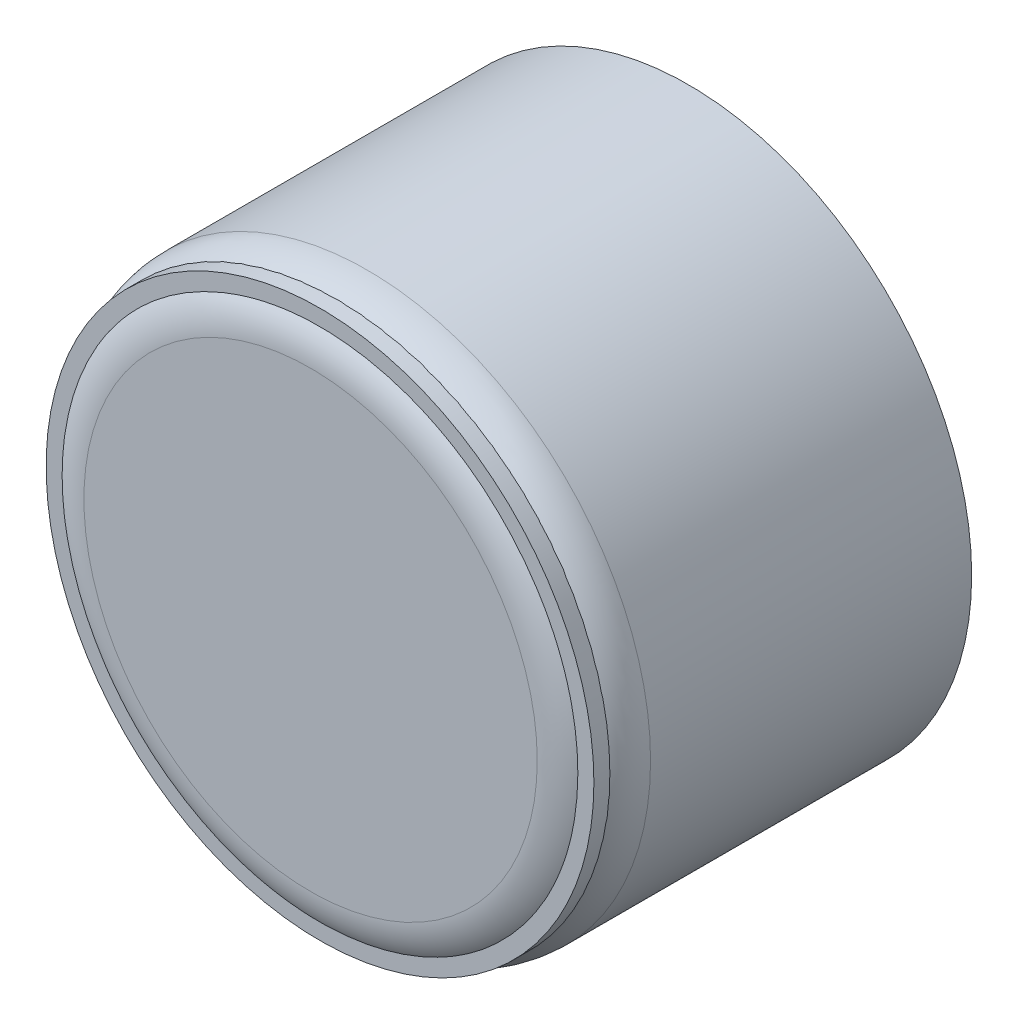
from build123d import *

# Parameters (mm, degrees)
SKETCH_1_R      = 15
EXTRUDE_1_DEPTH = 20
SHELL_1_T       = -0.5
FILLET_1_R      = 3


with BuildPart() as part:
    # 草图1 → 凸台-拉伸1 (new body)
    with BuildSketch(Plane.XY):
        Circle(SKETCH_1_R)
    extrude(amount=EXTRUDE_1_DEPTH)

    # 抽壳1
    shell_1_openings = [part.faces().sort_by_distance(p)[0] for p in [
        (0, 0, 0),
    ]]
    offset(amount=SHELL_1_T, openings=shell_1_openings, kind=Kind.INTERSECTION)

    # 圆角1
    fillet_1_edges = [part.edges().sort_by_distance(p)[0] for p in [
        (-15, 0, 20),
    ]]
    fillet(fillet_1_edges, radius=FILLET_1_R)


solid = part.part
